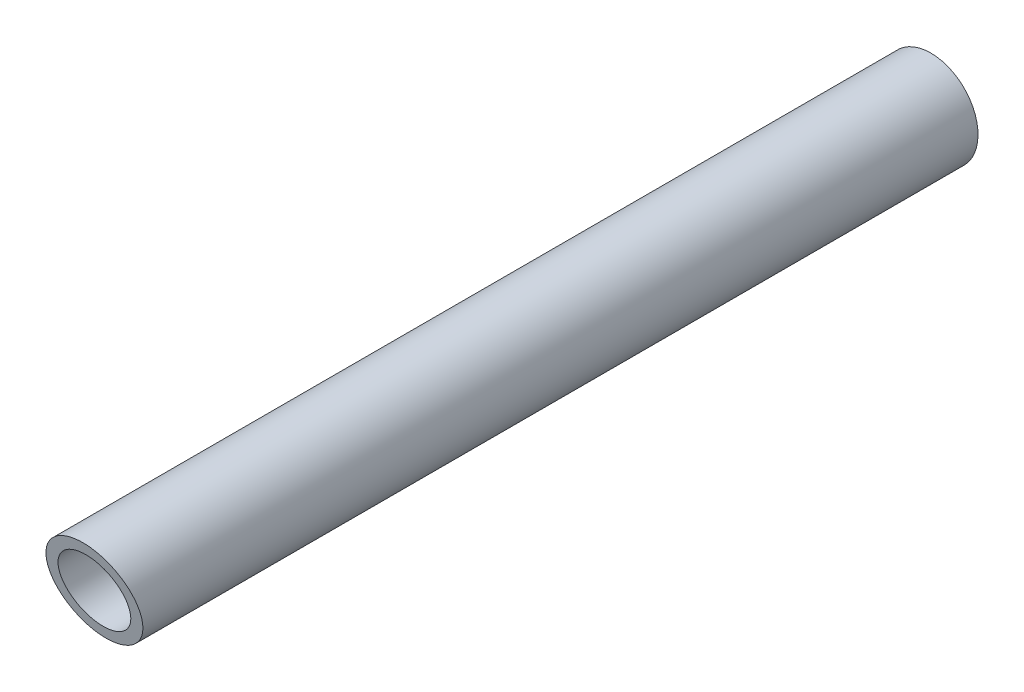
from build123d import *

# Parameters (mm, degrees)
BOSS_EXTRUDE1_DEPTH      = 114.3
BOSS_EXTRUDE1_DEPTH_BACK = 114.3
SKETCH3_R                = 12.7
SKETCH3_R_2              = 9.525


with BuildPart() as part:
    # Sketch3 → Boss-Extrude1 (new, two sides: drawn at the far end of the back side and taken through both)
    with BuildSketch(Plane.XY.offset(-BOSS_EXTRUDE1_DEPTH_BACK)):
        Circle(SKETCH3_R)
        Circle(SKETCH3_R_2, mode=Mode.SUBTRACT)
    extrude(amount=BOSS_EXTRUDE1_DEPTH + BOSS_EXTRUDE1_DEPTH_BACK)

    # SurfaceCut1
    split(bisect_by=Plane(origin=(0, -25.658113523, 104.919505636), x_dir=(1, 0, 0), z_dir=(0, -0.23755026507145888, 0.9713752475559997)), keep=Keep.BOTTOM)

    # SurfaceCut2
    split(bisect_by=Plane(origin=(0, -34.6229304, -8.467053608), x_dir=(-1, 0, 0), z_dir=(0, 0.9713752475559997, 0.23755026507145888)), keep=Keep.TOP)


solid = part.part
